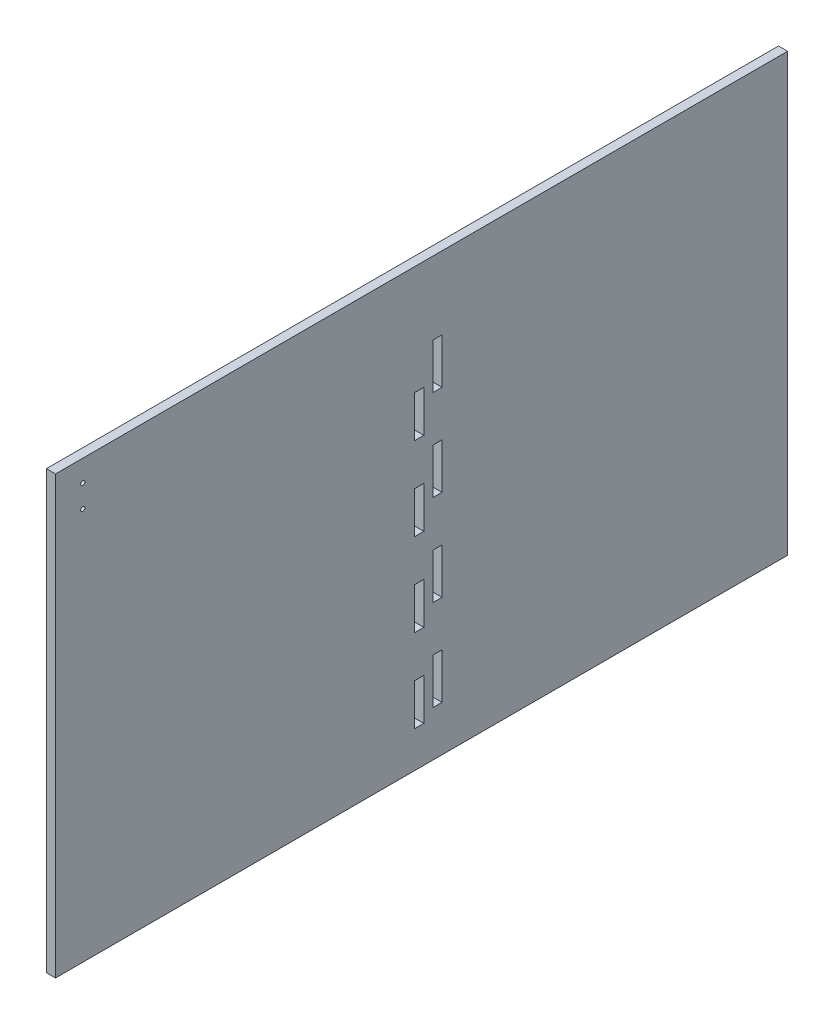
from build123d import *

# Parameters (mm, degrees)
BOSS_EXTRUDE1_DEPTH = 6.35
SKETCH3_W           = 6.35
SKETCH3_H           = 29.028571429
SKETCH3_H_2         = 31.75
CUT_EXTRUDE1_DEPTH  = 419.66682159
SKETCH4_R           = 1.5
CUT_EXTRUDE2_DEPTH  = 6.35
SKETCH5_W           = 6.35
SKETCH5_H           = 44.45
SKETCH5_W_2         = 59.592307692
SKETCH5_H_2         = 6.35
CUT_EXTRUDE3_DEPTH  = 6.35
SKETCH6_W           = 6.35
SKETCH6_H           = 222.25
BOSS_EXTRUDE2_DEPTH = 6.35
SKETCH7_W           = 774.7
SKETCH7_H           = 14.696452311
CUT_EXTRUDE4_DEPTH  = 6.35
SKETCH8_W           = 263.53
SKETCH8_H           = 304.8
CUT_EXTRUDE5_DEPTH  = 417.300498438


with BuildPart() as part:
    # Sketch1 → Boss-Extrude1 (new body)
    with BuildSketch(Plane(origin=(0, 0, 0), x_dir=(0, 0, -1), z_dir=(1, 0, 0))):
        Polygon((381, 152.4), (-387.35, 152.4), (-387.35, 107.95), (-381, 107.95), (-381, 63.5), (-387.35, 63.5), (-387.35, 19.05), (-381, 19.05), (-381, -25.4), (-387.35, -25.4), (-387.35, -69.85), (-381, -69.85), (-381, -114.3), (-387.35, -114.3), (-387.35, -152.4), (-327.757692308, -152.4), (-327.757692308, -158.75), (-268.165384615, -158.75), (-268.165384615, -152.4), (-208.573076923, -152.4), (-208.573076923, -158.75), (-148.980769231, -158.75), (-148.980769231, -152.4), (-89.388461538, -152.4), (-89.388461538, -158.75), (-29.796153846, -158.75), (-29.796153846, -152.4), (29.796153846, -152.4), (29.796153846, -158.75), (89.388461538, -158.75), (89.388461538, -152.4), (148.980769231, -152.4), (148.980769231, -158.75), (208.573076923, -158.75), (208.573076923, -152.4), (268.165384615, -152.4), (268.165384615, -158.75), (327.757692308, -158.75), (327.757692308, -152.4), (387.35, -152.4), (387.35, -114.3), (381, -114.3), (381, -69.85), (387.35, -69.85), (387.35, -25.4), (381, -25.4), (381, 19.05), (387.35, 19.05), (387.35, 63.5), (381, 63.5), (381, 107.95), (387.35, 107.95), (387.35, 152.4), align=None)
    extrude(amount=BOSS_EXTRUDE1_DEPTH)

    # Sketch3 → Cut-Extrude1 (cut, through all)
    with BuildSketch(Plane(origin=(6.35, 0, 0), x_dir=(0, 0, -1), z_dir=(1, 0, 0))):
        with Locations((-133.351230315, 61.685714285)):
            Rectangle(SKETCH3_W, SKETCH3_H)
        with Locations((-120.648769685, 85.725)):
            Rectangle(SKETCH3_W, SKETCH3_H_2)
        with Locations((-120.648769685, 22.225)):
            Rectangle(SKETCH3_W, SKETCH3_H_2)
        with Locations((-120.648769685, -41.275)):
            Rectangle(SKETCH3_W, SKETCH3_H_2)
        with Locations((-120.648769685, -104.775)):
            Rectangle(SKETCH3_W, SKETCH3_H_2)
        with Locations((-133.351230315, 3.628571428)):
            Rectangle(SKETCH3_W, SKETCH3_H)
        with Locations((-133.351230315, -54.428571428)):
            Rectangle(SKETCH3_W, SKETCH3_H)
        with Locations((-133.351230315, -112.485714286)):
            Rectangle(SKETCH3_W, SKETCH3_H)
    extrude(amount=-CUT_EXTRUDE1_DEPTH, mode=Mode.SUBTRACT)

    # Sketch4 → Cut-Extrude2 (cut)
    with BuildSketch(Plane(origin=(6.35, 0, 0), x_dir=(0, 0, -1), z_dir=(1, 0, 0))):
        with Locations((-368.3, 137.4)):
            Circle(SKETCH4_R)
        with Locations((-368.3, 121.65)):
            Circle(SKETCH4_R)
        with Locations((368.3, 137.4)):
            Circle(SKETCH4_R)
        with Locations((368.3, 121.65)):
            Circle(SKETCH4_R)
    extrude(amount=-CUT_EXTRUDE2_DEPTH, mode=Mode.SUBTRACT)

    # Sketch5 → Cut-Extrude3 (cut)
    with BuildSketch(Plane(origin=(6.35, 0, 0), x_dir=(0, 0, -1), z_dir=(1, 0, 0))):
        with Locations((-384.175, 41.275)):
            Rectangle(SKETCH5_W, SKETCH5_H)
        with Locations((-384.175, -47.625)):
            Rectangle(SKETCH5_W, SKETCH5_H)
        with Locations((-178.776923077, -155.575)):
            Rectangle(SKETCH5_W_2, SKETCH5_H_2)
        with Locations((-59.592307692, -155.575)):
            Rectangle(SKETCH5_W_2, SKETCH5_H_2)
        with Locations((59.592307692, -155.575)):
            Rectangle(SKETCH5_W_2, SKETCH5_H_2)
        with Locations((178.776923077, -155.575)):
            Rectangle(SKETCH5_W_2, SKETCH5_H_2)
        with Locations((384.175, -47.625)):
            Rectangle(SKETCH5_W, SKETCH5_H)
        with Locations((384.175, 41.275)):
            Rectangle(SKETCH5_W, SKETCH5_H)
    extrude(amount=-CUT_EXTRUDE3_DEPTH, mode=Mode.SUBTRACT)

    # Sketch6 → Boss-Extrude2 (add)
    with BuildSketch(Plane(origin=(6.35, 0, 0), x_dir=(0, 0, -1), z_dir=(1, 0, 0))):
        with Locations((-384.175, -3.175)):
            Rectangle(SKETCH6_W, SKETCH6_H)
        with Locations((384.175, -3.175)):
            Rectangle(SKETCH6_W, SKETCH6_H)
    extrude(amount=-BOSS_EXTRUDE2_DEPTH)

    # Sketch7 → Cut-Extrude4 (cut)
    with BuildSketch(Plane(origin=(6.35, 0, 0), x_dir=(0, 0, -1), z_dir=(1, 0, 0))):
        with Locations((0, -159.748226155)):
            Rectangle(SKETCH7_W, SKETCH7_H)
    extrude(amount=-CUT_EXTRUDE4_DEPTH, mode=Mode.SUBTRACT)

    # Sketch8 → Cut-Extrude5 (cut, through all)
    with BuildSketch(Plane(origin=(6.35, 0, 0), x_dir=(0, 0, -1), z_dir=(1, 0, 0))):
        with Locations((255.585, 0)):
            Rectangle(SKETCH8_W, SKETCH8_H)
    extrude(amount=-CUT_EXTRUDE5_DEPTH, mode=Mode.SUBTRACT)


solid = part.part
